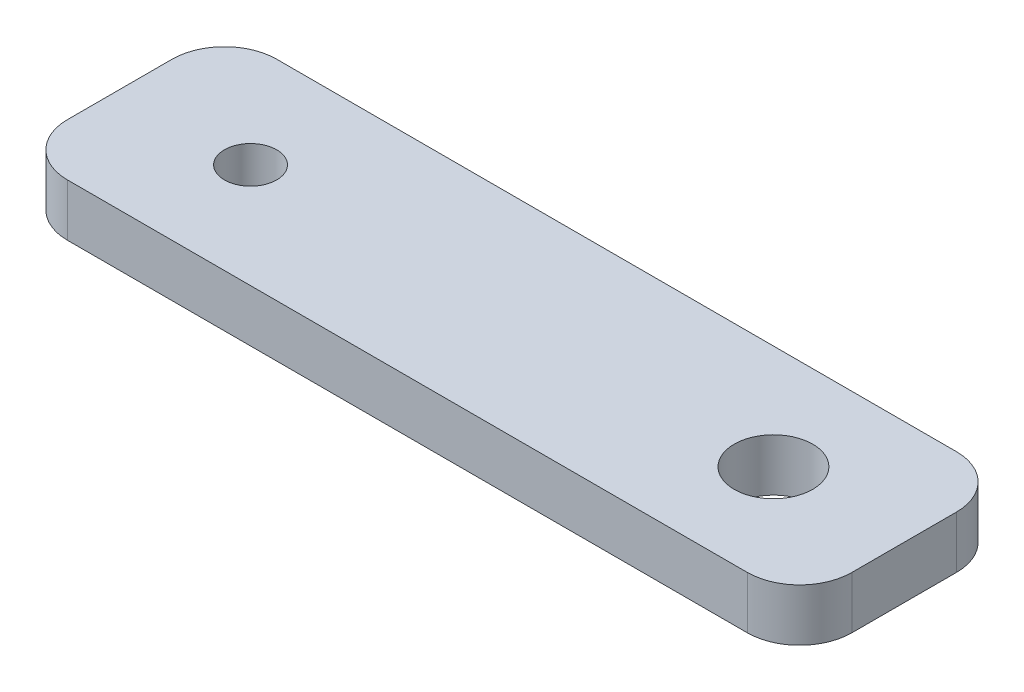
from build123d import *

# Parameters (mm, degrees)
SKETCH1_W           = 30
SKETCH1_H           = 8
BOSS_EXTRUDE1_DEPTH = 2
SKETCH2_R           = 1.5
CUT_EXTRUDE1_DEPTH  = 32.112698372
SKETCH3_R           = 1
CUT_EXTRUDE2_DEPTH  = 32.112698372
FILLET1_R           = 2


with BuildPart() as part:
    # Sketch1 → Boss-Extrude1 (new body)
    with BuildSketch(Plane(origin=(0, 0, 0), x_dir=(1, 0, 0), z_dir=(0, 1, 0))):
        with Locations((15, -4)):
            Rectangle(SKETCH1_W, SKETCH1_H)
    extrude(amount=BOSS_EXTRUDE1_DEPTH)

    # Sketch2 → Cut-Extrude1 (cut, through all)
    with BuildSketch(Plane(origin=(0, 2, 0), x_dir=(1, 0, 0), z_dir=(0, 1, 0))):
        with Locations(Location((25, -4, 0), (0, 0, 270))):
            Circle(SKETCH2_R)
    extrude(amount=-CUT_EXTRUDE1_DEPTH, mode=Mode.SUBTRACT)

    # Sketch3 → Cut-Extrude2 (cut, through all)
    with BuildSketch(Plane(origin=(0, 2, 0), x_dir=(1, 0, 0), z_dir=(0, 1, 0))):
        with Locations(Location((5, -4, 0), (0, 0, 270))):
            Circle(SKETCH3_R)
    extrude(amount=-CUT_EXTRUDE2_DEPTH, mode=Mode.SUBTRACT)

    # Fillet1
    fillet1_edges = [part.edges().sort_by_distance(p)[0] for p in [
        (0, 1, 0),
        (30, 1, 0),
        (30, 1, 8),
        (0, 1, 8),
    ]]
    fillet(fillet1_edges, radius=FILLET1_R)


solid = part.part
